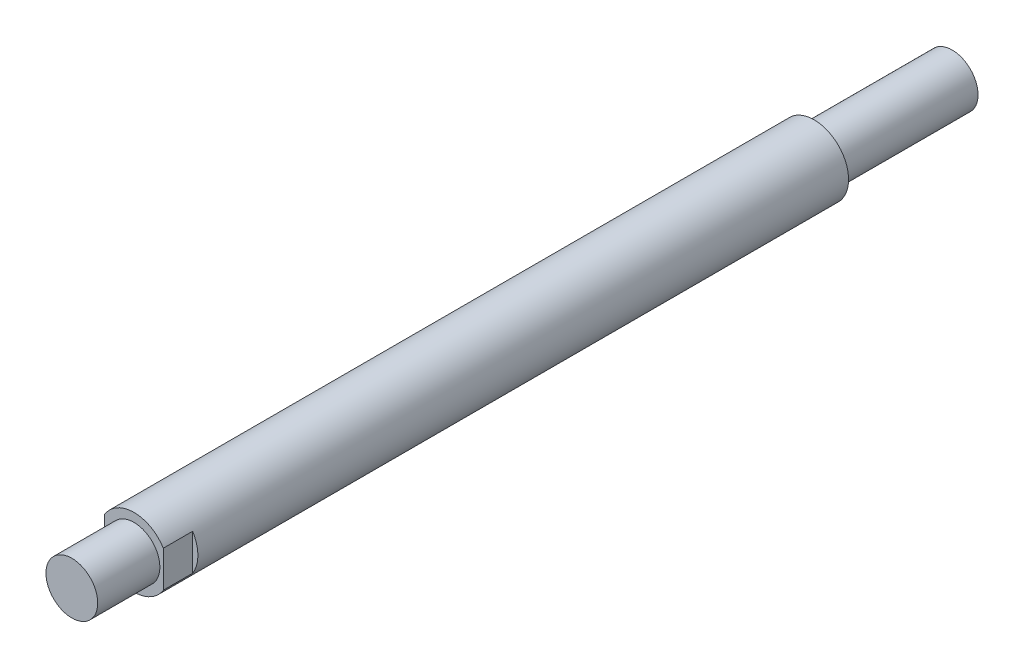
from build123d import *

# Parameters (mm, degrees)
SKETCH1_R           = 20
BOSS_EXTRUDE1_DEPTH = 255
SKETCH2_R           = 20
SKETCH2_R_2         = 15
CUT_EXTRUDE1_DEPTH  = 36
SKETCH3_W           = 9.924415088
SKETCH3_H           = 50.469281605
SKETCH3_W_2         = 14.039416466
SKETCH3_H_2         = 45.628103513
CUT_EXTRUDE2_DEPTH  = 17
CUT_EXTRUDE4_START  = -80
SKETCH4_R           = 20
SKETCH4_R_2         = 15
CUT_EXTRUDE4_DEPTH  = 80


with BuildPart() as part:
    # Sketch1 → Boss-Extrude1 (new, symmetric)
    with BuildSketch(Plane.XY):
        Circle(SKETCH1_R)
    extrude(amount=BOSS_EXTRUDE1_DEPTH, both=True)

    # Sketch2 → Cut-Extrude1 (cut)
    with BuildSketch(Plane.XY.offset(255)):
        Circle(SKETCH2_R)
        Circle(SKETCH2_R_2, mode=Mode.SUBTRACT)
    extrude(amount=-CUT_EXTRUDE1_DEPTH, mode=Mode.SUBTRACT)

    # Sketch3 → Cut-Extrude2 (cut)
    with BuildSketch(Plane.XY.offset(219)):
        with Locations((-21.962207544, 3.05599367)):
            Rectangle(SKETCH3_W, SKETCH3_H)
        with Locations((24.019708233, 0.635404624)):
            Rectangle(SKETCH3_W_2, SKETCH3_H_2)
    extrude(amount=-CUT_EXTRUDE2_DEPTH, mode=Mode.SUBTRACT)

    # Sketch4 → Cut-Extrude4 (cut)
    with BuildSketch(Plane(origin=(0, 0, -255), x_dir=(-1, 0, 0), z_dir=(0, 0, -1)).offset(CUT_EXTRUDE4_START)):
        Circle(SKETCH4_R)
        with Locations(Location((0, 0, 0), (0, 0, 180))):
            Circle(SKETCH4_R_2, mode=Mode.SUBTRACT)
    extrude(amount=CUT_EXTRUDE4_DEPTH, mode=Mode.SUBTRACT)


solid = part.part
